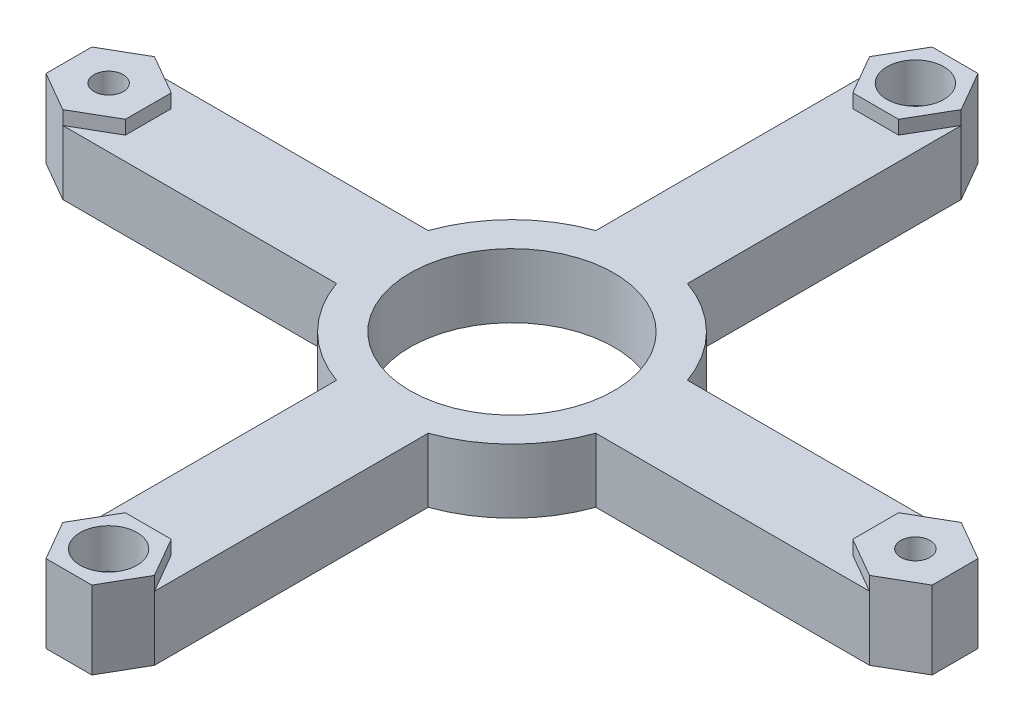
from build123d import *

# Parameters (mm, degrees)
SKETCH1_R           = 11.125
SKETCH1_R_2         = 1.6
BOSS_EXTRUDE1_DEPTH = 7
SKETCH3_R           = 3.1
CUT_EXTRUDE1_DEPTH  = 2.8
SKETCH2_R           = 1.6
SKETCH2_R_2         = 3.1
BOSS_EXTRUDE2_DEPTH = 1.5


with BuildPart() as part:
    # Sketch1 → Boss-Extrude1 (new body)
    with BuildSketch(Plane(origin=(0, 0, 0), x_dir=(1, 0, 0), z_dir=(0, 1, 0))):
        with BuildLine():
            Line((44, 5), (48.330127019, 2.5))
            Line((48.330127019, 2.5), (48.330127019, -2.5))
            Line((48.330127019, -2.5), (44, -5))
            Line((44, -5), (14.142135624, -5))
            ThreePointArc((14.142135624, -5), (10.606601718, -10.606601718), (5, -14.142135624))
            Line((5, -14.142135624), (5, -44))
            Line((5, -44), (2.5, -48.330127019))
            Line((2.5, -48.330127019), (-2.5, -48.330127019))
            Line((-2.5, -48.330127019), (-5, -44))
            Line((-5, -44), (-5, -14.142135624))
            ThreePointArc((-5, -14.142135624), (-10.606601718, -10.606601718), (-14.142135624, -5))
            Line((-14.142135624, -5), (-44, -5))
            Line((-44, -5), (-48.330127019, -2.5))
            Line((-48.330127019, -2.5), (-48.330127019, 2.5))
            Line((-48.330127019, 2.5), (-44, 5))
            Line((-44, 5), (-14.142135624, 5))
            ThreePointArc((-14.142135624, 5), (-10.606601718, 10.606601718), (-5, 14.142135624))
            Line((-5, 14.142135624), (-5, 44))
            Line((-5, 44), (-2.5, 48.330127019))
            Line((-2.5, 48.330127019), (2.5, 48.330127019))
            Line((2.5, 48.330127019), (5, 44))
            Line((5, 44), (5, 14.142135624))
            ThreePointArc((5, 14.142135624), (10.606601718, 10.606601718), (14.142135624, 5))
            Line((14.142135624, 5), (44, 5))
        make_face()
        with Locations(Location((0, 0, 0), (0, 0, 270))):
            Circle(SKETCH1_R, mode=Mode.SUBTRACT)
        with Locations(Location((44, 0, 0), (0, 0, 270))):
            Circle(SKETCH1_R_2, mode=Mode.SUBTRACT)
        with Locations(Location((0, 44, 0), (0, 0, 270))):
            Circle(SKETCH1_R_2, mode=Mode.SUBTRACT)
        with Locations(Location((-44, 0, 0), (0, 0, 270))):
            Circle(SKETCH1_R_2, mode=Mode.SUBTRACT)
        with Locations(Location((0, -44, 0), (0, 0, 270))):
            Circle(SKETCH1_R_2, mode=Mode.SUBTRACT)
    extrude(amount=BOSS_EXTRUDE1_DEPTH)

    # Sketch3 → Cut-Extrude1 (cut)
    with BuildSketch(Plane(origin=(0, 7, 0), x_dir=(1, 0, 0), z_dir=(0, 1, 0))):
        with Locations(Location((0, 44, 0), (0, 0, 270))):
            Circle(SKETCH3_R)
        with Locations(Location((0, -44, 0), (0, 0, 270))):
            Circle(SKETCH3_R)
    extrude(amount=-CUT_EXTRUDE1_DEPTH, mode=Mode.SUBTRACT)

    # Sketch2 → Boss-Extrude2 (add)
    # profile 1 of 4: a face of its own
    with BuildSketch(Plane(origin=(0, 7, 0), x_dir=(1, 0, 0), z_dir=(0, 1, 0))):
        Polygon((-44, 5), (-48.330127019, 2.5), (-48.330127019, -2.5), (-44, -5), (-39.669872981, -2.5), (-39.669872981, 2.5), align=None)
        with Locations(Location((-44, 0, 0), (0, 0, 270))):
            Circle(SKETCH2_R, mode=Mode.SUBTRACT)
    # profile 2 of 4: a face of its own
    with BuildSketch(Plane(origin=(0, 7, 0), x_dir=(1, 0, 0), z_dir=(0, 1, 0))):
        Polygon((48.330127019, 2.5), (44, 5), (39.669872981, 2.5), (39.669872981, -2.5), (44, -5), (48.330127019, -2.5), align=None)
        with Locations(Location((44, 0, 0), (0, 0, 270))):
            Circle(SKETCH2_R, mode=Mode.SUBTRACT)
    # profile 3 of 4: a face of its own
    with BuildSketch(Plane(origin=(0, 7, 0), x_dir=(1, 0, 0), z_dir=(0, 1, 0))):
        Polygon((2.5, 48.330127019), (-2.5, 48.330127019), (-5, 44), (-2.5, 39.669872981), (2.5, 39.669872981), (5, 44), align=None)
        with Locations(Location((0, 44, 0), (0, 0, 270))):
            Circle(SKETCH2_R_2, mode=Mode.SUBTRACT)
    # profile 4 of 4: a face of its own
    with BuildSketch(Plane(origin=(0, 7, 0), x_dir=(1, 0, 0), z_dir=(0, 1, 0))):
        Polygon((-2.5, -48.330127019), (2.5, -48.330127019), (5, -44), (2.5, -39.669872981), (-2.5, -39.669872981), (-5, -44), align=None)
        with Locations(Location((0, -44, 0), (0, 0, 270))):
            Circle(SKETCH2_R_2, mode=Mode.SUBTRACT)
    extrude(amount=BOSS_EXTRUDE2_DEPTH)


solid = part.part
